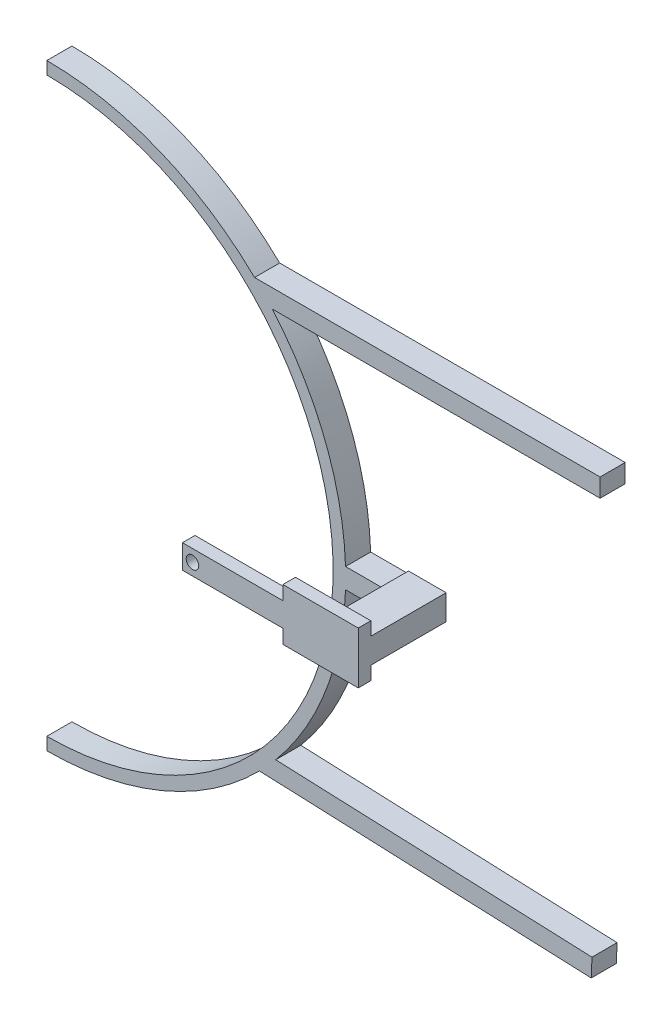
from build123d import *

# Parameters (mm, degrees)
SKETCH1_R           = 2.5
BOSS_EXTRUDE1_DEPTH = 5
SKETCH2_W           = 15
SKETCH2_H           = 10
BOSS_EXTRUDE2_DEPTH = 30
SKETCH3_W           = 10
SKETCH3_H           = 8
BOSS_EXTRUDE3_DEPTH = 20
BOSS_EXTRUDE5_DEPTH = 10
BOSS_EXTRUDE6_DEPTH = 10


with BuildPart() as part:
    # Sketch1 → Boss-Extrude1 (new body)
    with BuildSketch(Plane.XY):
        Polygon((-15, 4.74891783), (-15, 10.327635328), (15, 10.327635328), (15, -10.327635328), (-15, -10.327635328), (-15, -4.74891783), (-55, -4.74891783), (-55, 4.74891783), align=None)
        with Locations((-51, 0)):
            Circle(SKETCH1_R, mode=Mode.SUBTRACT)
    extrude(amount=BOSS_EXTRUDE1_DEPTH)

    # Sketch2 → Boss-Extrude2 (add)
    with BuildSketch(Plane(origin=(0, 0, 0), x_dir=(-1, 0, 0), z_dir=(0, 0, -1))):
        with Locations((-7.5, 0)):
            Rectangle(SKETCH2_W, SKETCH2_H)
    extrude(amount=BOSS_EXTRUDE2_DEPTH)

    # Sketch3 → Boss-Extrude3 (add)
    with BuildSketch(Plane.ZY):
        with Locations((-25, 0)):
            Rectangle(SKETCH3_W, SKETCH3_H)
    extrude(amount=BOSS_EXTRUDE3_DEPTH)

    # Sketch5 → Boss-Extrude5 (add)
    with BuildSketch(Plane(origin=(0, 0, -30), x_dir=(-1, 0, 0), z_dir=(0, 0, -1))):
        with BuildLine():
            Line((134, -114), (134, -119))
            ThreePointArc((134, -119), (15, 0), (134, 119))
            Line((134, 119), (134, 114))
            ThreePointArc((134, 114), (20, 0), (134, -114))
        make_face()
    extrude(amount=-BOSS_EXTRUDE5_DEPTH)

    # Sketch6 → Boss-Extrude6 (add)
    with BuildSketch(Plane(origin=(0, 0, -30), x_dir=(-1, 0, 0), z_dir=(0, 0, -1))):
        with BuildLine():
            Line((51.28059478, 85.54823201), (-86.273042092, 85.54823201))
            Line((-86.273042092, 85.54823201), (-86.273042092, 78.202780321))
            Line((-86.273042092, 78.202780321), (44.304263479, 78.202780321))
            ThreePointArc((44.304263479, 78.202780321), (47.714229501, 81.94977614), (51.28059478, 85.54823201))
        make_face()
        with BuildLine():
            Line((-83.044588659, -81.622968191), (47.426200609, -76.349840264))
            ThreePointArc((47.426200609, -76.349840264), (50.984700645, -79.956074232), (54.69347384, -83.407573519))
            Line((54.69347384, -83.407573519), (-82.7479559, -88.962427947))
            Line((-82.7479559, -88.962427947), (-83.044588659, -81.622968191))
        make_face()
    extrude(amount=-BOSS_EXTRUDE6_DEPTH)


solid = part.part
